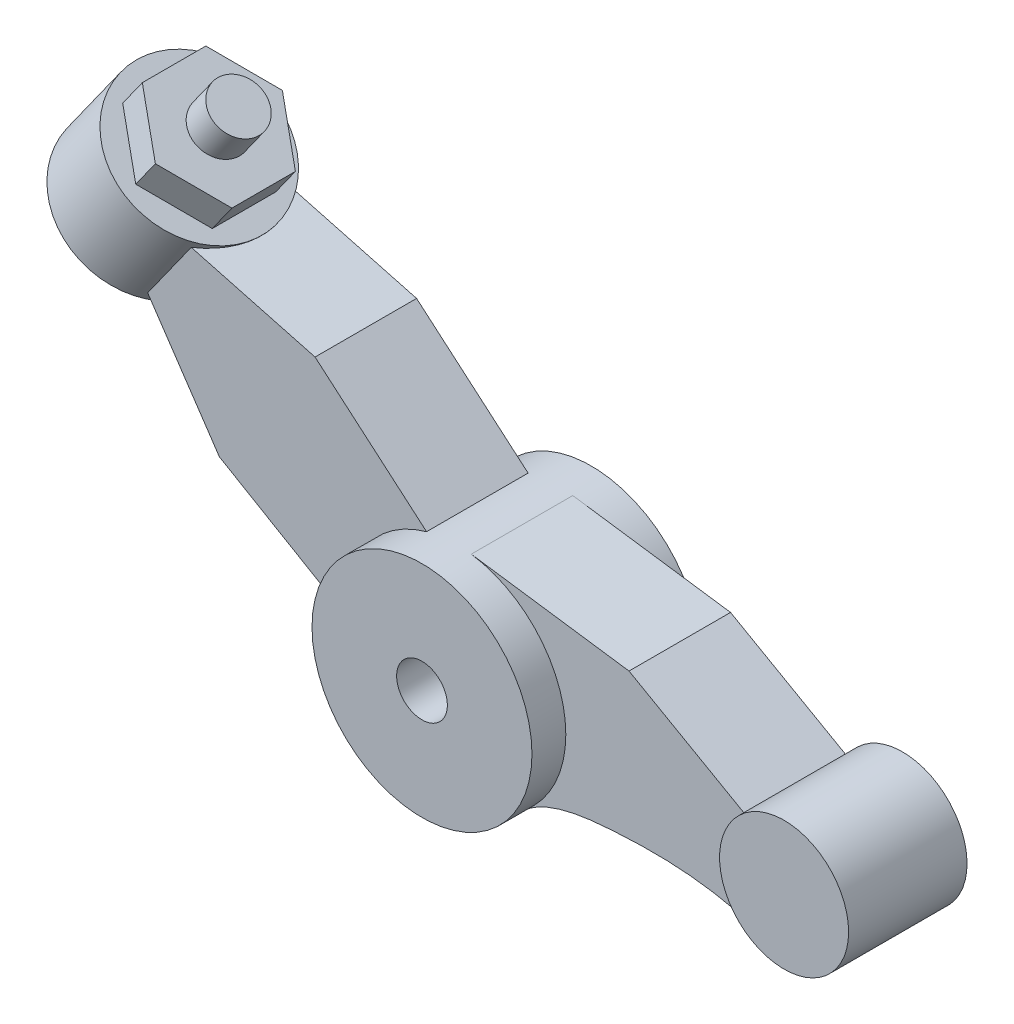
from build123d import *

# Parameters (mm, degrees)
SKETCH1_R           = 7.62
BOSS_EXTRUDE1_DEPTH = 25.4
BOSS_EXTRUDE2_DEPTH = 17.78
BOSS_EXTRUDE3_DEPTH = 15.24
BOSS_EXTRUDE4_DEPTH = 15.24
BOSS_EXTRUDE5_DEPTH = 10.16
SKETCH8_R           = 7.62
BOSS_EXTRUDE6_DEPTH = 10.16


with BuildPart() as part:
    # Sketch1 → Boss-Extrude1 (new, symmetric)
    with BuildSketch(Plane.XY):
        with BuildLine():
            ThreePointArc((33.02, 0), (24.930864244, 21.651152581), (4.626759051, 32.694242623))
            ThreePointArc((4.626759051, 32.694242623), (-2.121746437, 32.951761593), (-8.781498221, 31.830892055))
            ThreePointArc((-8.781498221, 31.830892055), (-26.892130639, 19.160733538), (-32.953500531, -2.094565059))
            ThreePointArc((-32.953500531, -2.094565059), (-13.239146526, -30.249717342), (20.819898028, -25.62912886))
            ThreePointArc((20.819898028, -25.62912886), (29.814370972, -14.19238118), (33.02, 0))
        make_face()
        Circle(SKETCH1_R, mode=Mode.SUBTRACT)
    extrude(amount=BOSS_EXTRUDE1_DEPTH, both=True)



with BuildPart() as body_2:
    # Sketch1<3> → Boss-Extrude2 (new, symmetric)
    with BuildSketch(Plane.XY):
        with BuildLine():
            ThreePointArc((120.4595, -6.347255181), (107.889218857, 11.7882865), (86.495604602, 6.382446214))
            ThreePointArc((86.495604602, 6.382446214), (81.821344439, -8.281651859), (89.316955097, -21.724133075))
            ThreePointArc((89.316955097, -21.724133075), (109.666580867, -23.713216693), (120.4595, -6.347255181))
        make_face()
    extrude(amount=BOSS_EXTRUDE2_DEPTH, both=True)


with BuildPart() as part_1:
    add(part.part)

    add(body_2.part)  # Boss-Extrude3 merges body 2
    # Sketch1<4> → Boss-Extrude3 (add, symmetric)
    with BuildSketch(Plane.XY):
        with BuildLine():
            ThreePointArc((89.316955097, -21.724133075), (81.821344439, -8.281651859), (86.495604602, 6.382446214))
            Line((86.495604602, 6.382446214), (51.99535192, 25.990827948))
            Line((51.99535192, 25.990827948), (4.626759051, 32.694242623))
            ThreePointArc((4.626759051, 32.694242623), (24.930864244, 21.651152581), (33.02, 0))
            ThreePointArc((33.02, 0), (29.814370972, -14.19238118), (20.819898028, -25.62912886))
            add(Edge.make_bspline(
                [(89.316955097, -21.724133075), (75.276461203, -17.426169931), (52.836610599, -16.671014881), (28.008203074, -19.789688164), (20.819898028, -25.62912886)],
                knots=[0, 0, 0, 0, 0.609501507, 1, 1, 1, 1], degree=3))
        make_face()
    extrude(amount=BOSS_EXTRUDE3_DEPTH, both=True)

    # Sketch1<5> → Boss-Extrude4 (add, symmetric)
    with BuildSketch(Plane.XY):
        with BuildLine():
            ThreePointArc((-32.953500531, -2.094565059), (-26.892130639, 19.160733538), (-8.781498221, 31.830892055))
            Line((-8.781498221, 31.830892055), (-42.262603979, 60.502117005))
            Line((-42.262603979, 60.502117005), (-86.872548051, 72.422885384))
            Line((-86.872548051, 72.422885384), (-96.821390465, 58.459663706))
            Line((-96.821390465, 58.459663706), (-70.986413412, 20.188188826))
            Line((-70.986413412, 20.188188826), (-32.953500531, -2.094565059))
        make_face()
    extrude(amount=BOSS_EXTRUDE4_DEPTH, both=True)



with BuildPart() as body_2_2:
    # Sketch5 → Revolve2 (revolve)
    with BuildSketch(Plane.XY):
        with BuildLine():
            Line((-96.821390465, 58.459663706), (-86.20929189, 73.353766829))
            Line((-86.20929189, 73.353766829), (-94.483793625, 79.249377149))
            Line((-94.483793625, 79.249377149), (-122.603936438, 39.782696366))
            ThreePointArc((-122.603936438, 39.782696366), (-111.841735812, 40.121260824), (-109.299895081, 50.584464631))
            Line((-109.299895081, 50.584464631), (-96.821390465, 58.459663706))
        make_face()
    revolve(axis=Axis((-94.483793625, 79.249377149, 0), (-0.5802766062403011, -0.8144194621018328, 0)))


with BuildPart() as part_2:
    add(part_1.part)

    add(body_2_2.part)  # Revolve4 merges body 2 2
    # Sketch6 → Revolve4 (revolve)
    with BuildSketch(Plane.XY):
        Polygon((-108.193400918, 60.007913893), (-92.275253056, 82.349068577), (-111.099744503, 95.761582054), (-127.017892365, 73.42042737), align=None)
    revolve(axis=Axis((-94.483793625, 79.249377149, 0), (-0.5802766062403006, -0.8144194621018331, 0)))

    # Sketch7 → Boss-Extrude5 (add)
    with BuildSketch(Plane(origin=(7.846217937, 11.012183713, 0), x_dir=(0.814419462101833, -0.5802766062403008, 0), z_dir=(0.5802766062403008, 0.8144194621018331, 0))):
        Polygon((-106.426, -9.532052944), (-106.426, 9.532052944), (-122.936, 19.064105889), (-139.446, 9.532052944), (-139.446, -9.532052944), (-122.936, -19.064105889), align=None)
    extrude(amount=BOSS_EXTRUDE5_DEPTH)

    # Sketch8 → Boss-Extrude6 (add)
    with BuildSketch(Plane(origin=(13.741828257, 19.286685448, 0), x_dir=(0.814419462101833, -0.5802766062403008, 0), z_dir=(0.5802766062403008, 0.8144194621018331, 0))):
        with Locations((-122.936, 0)):
            Circle(SKETCH8_R)
    extrude(amount=BOSS_EXTRUDE6_DEPTH)


solid = part_2.part
